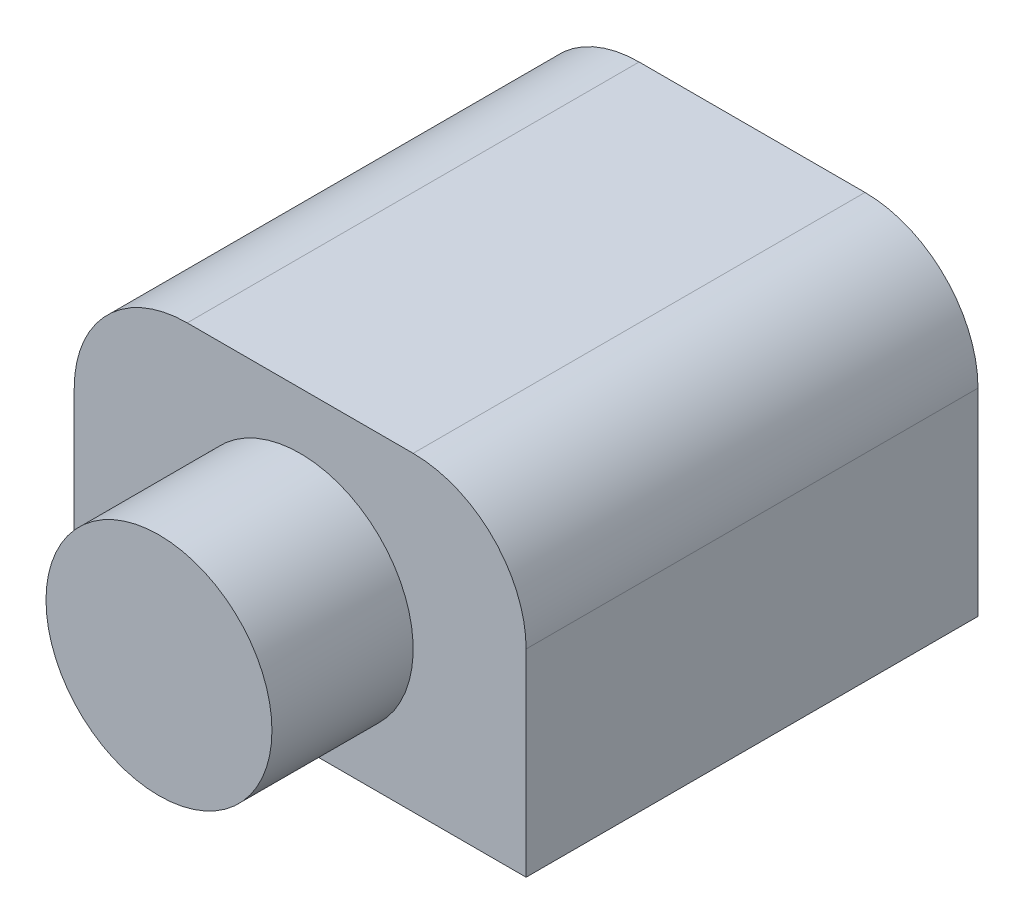
from build123d import *

# Parameters (mm, degrees)
ESBO_O1_W                = 80
ESBO_O1_H                = 80
RESSALTO_EXTRUS_O1_DEPTH = 190
FILETE2_R                = 20
ESBO_O2_R                = 20
RESSALTO_EXTRUS_O2_DEPTH = 25
ESBO_O3_W                = 70
ESBO_O3_H                = 70
CORTE_EXTRUS_O1_DEPTH    = 135
ESBO_O4_R                = 15
CORTE_EXTRUS_O2_DEPTH    = 5


with BuildPart() as part:
    # Esboço1 → Ressalto-extrusão1 (new body)
    with BuildSketch(Plane(origin=(0, 0, 0), x_dir=(1, 0, 0), z_dir=(0, 1, 0))):
        Rectangle(ESBO_O1_W, ESBO_O1_H)
    extrude(amount=RESSALTO_EXTRUS_O1_DEPTH)

    # Filete2
    filete2_edges = [part.edges().sort_by_distance(p)[0] for p in [
        (40, 190, 0),
        (-40, 190, 0),
    ]]
    fillet(filete2_edges, radius=FILETE2_R)

    # Esboço2 → Ressalto-extrusão2 (add)
    with BuildSketch(Plane.XY.offset(40)):
        with Locations(Location((0, 160, 0), (0, 0, 180))):
            Circle(ESBO_O2_R)
    extrude(amount=RESSALTO_EXTRUS_O2_DEPTH)

    # Esboço3 → Corte-extrusão1 (cut)
    with BuildSketch(Plane(origin=(0, 0, 0), x_dir=(-1, 0, 0), z_dir=(0, -1, 0))):
        Rectangle(ESBO_O3_W, ESBO_O3_H)
    extrude(amount=-CORTE_EXTRUS_O1_DEPTH, mode=Mode.SUBTRACT)

    # Esboço4 → Corte-extrusão2 (cut)
    with BuildSketch(Plane.XY.offset(40)):
        with Locations((0, 90)):
            Circle(ESBO_O4_R)
    extrude(amount=-CORTE_EXTRUS_O2_DEPTH, mode=Mode.SUBTRACT)

    # Corte de superfície1
    split(bisect_by=Plane(origin=(0, 135, 0), x_dir=(1, 0, 0), z_dir=(0, 1, 0)), keep=Keep.TOP)


solid = part.part
